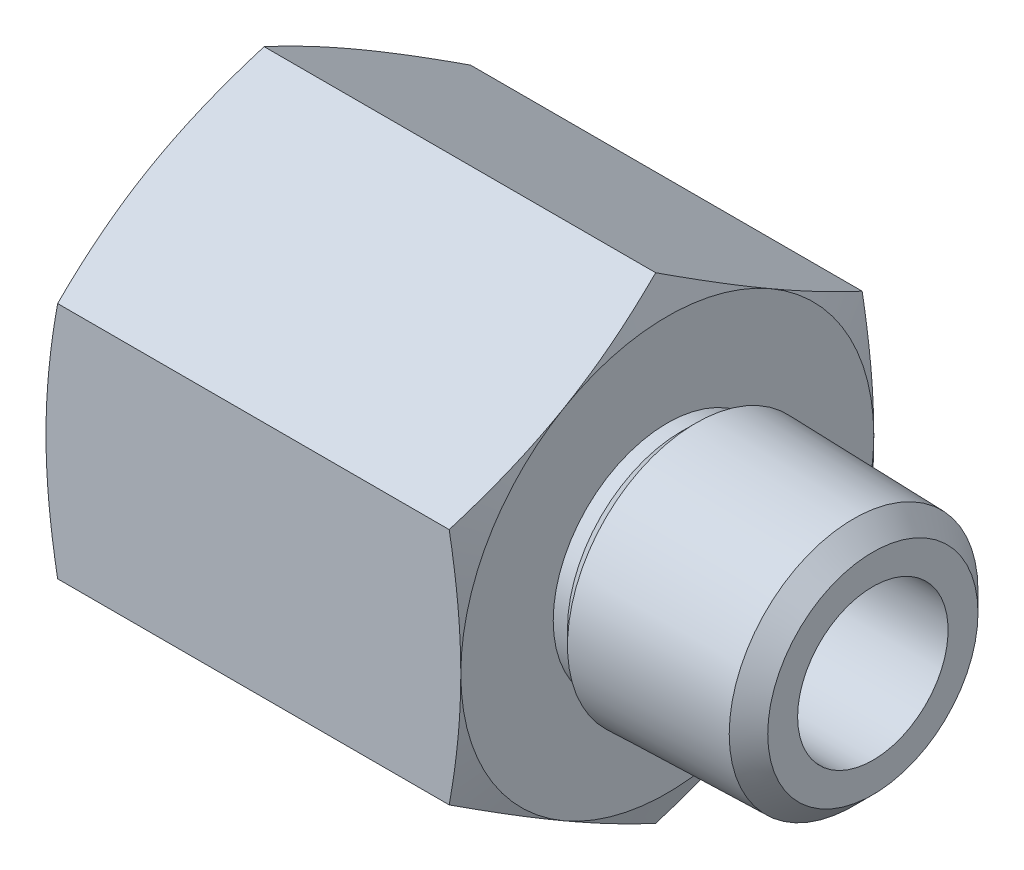
from build123d import *

# Parameters (mm, degrees)
EXTRUDE1_DEPTH     = 28.702
SKETCH3_OUTSIDE_W  = 244.651
SKETCH3_OUTSIDE_H  = 249.072
SKETCH3_OUTSIDE_R  = 14.2875
CUT_EXTRUDE1_DEPTH = 37.057098264
CUT_EXTRUDE1_DRAFT = -70
SKETCH4_OUTSIDE_W  = 244.652
SKETCH4_OUTSIDE_H  = 249.072
SKETCH4_OUTSIDE_R  = 14.2875
CUT_EXTRUDE2_DEPTH = 37.057098264
CUT_EXTRUDE2_DRAFT = -70
SKETCH5_R          = 8.5725
EXTRUDE2_DEPTH     = 14.224
EXTRUDE2_DRAFT     = 1.5
SKETCH7_R          = 10.668
CUT_EXTRUDE4_DEPTH = 37.591086429
CUT_EXTRUDE4_DRAFT = 1.5
SKETCH12_W         = 6.35
SKETCH12_H         = 16.497783942
SKETCH15_R         = 11.276975829
CUT_EXTRUDE7_DEPTH = 5.08
CUT_EXTRUDE7_DRAFT = -45


with BuildPart() as part:
    # Sketch2 → Extrude1 (new body)
    with BuildSketch(Plane(origin=(-21.463, 0, 0), x_dir=(0, 0, -1), z_dir=(1, 0, 0))):
        Polygon((0, 16.497783942), (-14.2875, 8.248891971), (-14.2875, -8.248891971), (0, -16.497783942), (14.2875, -8.248891971), (14.2875, 8.248891971), align=None)
    extrude(amount=EXTRUDE1_DEPTH)


with BuildPart() as cut_extrude1_tool:
    # Sketch3 outside → Cut-Extrude1 (with draft: the straight prism first)
    with BuildSketch(Plane(origin=(7.239, 0, 0), x_dir=(0, 0, -1), z_dir=(1, 0, 0))):
        with Locations((-0.0005, 0)):
            Rectangle(SKETCH3_OUTSIDE_W, SKETCH3_OUTSIDE_H)
        Circle(SKETCH3_OUTSIDE_R, mode=Mode.SUBTRACT)
    extrude(amount=-CUT_EXTRUDE1_DEPTH)
    # Cut-Extrude1: the draft: its side faces are tilted about the plane it starts from
    cut_extrude1_sides = [cut_extrude1_tool.faces().sort_by_distance(p)[0] for p in [
        (-11.289549132, -124.536, 0.0005),
        (-11.289549132, 0, -122.325),
        (-11.289549132, 124.536, 0.0005),
        (-11.289549132, 0, 122.326),
        (-11.289549132, 0, 14.2875),
    ]]
    draft(cut_extrude1_sides, Plane(origin=(7.239, 0, 0), x_dir=(0, 0, -1), z_dir=(1, 0, 0)), CUT_EXTRUDE1_DRAFT)


with BuildPart() as part_1:
    add(part.part)

    # Cut-Extrude1: cut by cut_extrude1_tool
    add(cut_extrude1_tool.part, mode=Mode.SUBTRACT)


with BuildPart() as cut_extrude2_tool:
    # Sketch4 outside → Cut-Extrude2 (with draft: the straight prism first)
    with BuildSketch(Plane.ZY.offset(21.463)):
        Rectangle(SKETCH4_OUTSIDE_W, SKETCH4_OUTSIDE_H)
        Circle(SKETCH4_OUTSIDE_R, mode=Mode.SUBTRACT)
    extrude(amount=-CUT_EXTRUDE2_DEPTH)
    # Cut-Extrude2: the draft: its side faces are tilted about the plane it starts from
    cut_extrude2_sides = [cut_extrude2_tool.faces().sort_by_distance(p)[0] for p in [
        (-2.934450868, -124.536, 0),
        (-2.934450868, 0, 122.326),
        (-2.934450868, 124.536, 0),
        (-2.934450868, 0, -122.326),
        (-2.934450868, 0, -14.2875),
    ]]
    draft(cut_extrude2_sides, Plane.ZY.offset(21.463), CUT_EXTRUDE2_DRAFT)


with BuildPart() as part_2:
    add(part_1.part)

    # Cut-Extrude2: cut by cut_extrude2_tool
    add(cut_extrude2_tool.part, mode=Mode.SUBTRACT)


with BuildPart() as body_2:
    # Sketch5 → Extrude2 (with draft: the straight prism first)
    with BuildSketch(Plane(origin=(21.463, 0, 0), x_dir=(0, 0, -1), z_dir=(1, 0, 0))):
        Circle(SKETCH5_R)
    extrude(amount=-EXTRUDE2_DEPTH)
    # Extrude2: the draft: its side faces are tilted about the plane it starts from
    extrude2_sides = [body_2.faces().sort_by_distance(p)[0] for p in [
        (14.351, 0, 8.5725),
    ]]
    draft(extrude2_sides, Plane(origin=(21.463, 0, 0), x_dir=(0, 0, -1), z_dir=(1, 0, 0)), EXTRUDE2_DRAFT)

    # Sketch17 → Cut-Revolve2 (revolve, cut)
    with BuildSketch(Plane.XY, mode=Mode.PRIVATE) as cut_revolve2_sk:
        Polygon((21.463, 8.814890815), (21.463, 7.274956448), (19.923065632, 8.814890815), align=None)
        Polygon((7.239, 7.893804996), (8.226777778, 7.893804996), (9.528863597, 9.195890815), (7.239, 9.195890815), align=None)
    revolve(cut_revolve2_sk.sketch.rotate(Axis((-21.463, 0, 0), (1, 0, 0)), 270), axis=Axis((-21.463, 0, 0), (1, 0, 0)), mode=Mode.SUBTRACT)


with BuildPart() as cut_extrude4_tool:
    # Sketch7 → Cut-Extrude4 (with draft: the straight prism first)
    with BuildSketch(Plane(origin=(-7.90702, 0, 0), x_dir=(0, 0, -1), z_dir=(1, 0, 0))):
        Circle(SKETCH7_R)
    extrude(amount=-CUT_EXTRUDE4_DEPTH)
    # Cut-Extrude4: the draft: its side faces are tilted about the plane it starts from
    cut_extrude4_sides = [cut_extrude4_tool.faces().sort_by_distance(p)[0] for p in [
        (-26.702563214, 0, 10.668),
    ]]
    draft(cut_extrude4_sides, Plane(origin=(-7.90702, 0, 0), x_dir=(0, 0, -1), z_dir=(1, 0, 0)), CUT_EXTRUDE4_DRAFT)


with BuildPart() as part_3:
    add(part_2.part)

    # Cut-Extrude4: cut by cut_extrude4_tool
    add(cut_extrude4_tool.part, mode=Mode.SUBTRACT)


with BuildPart() as body_2_1:
    add(body_2.part)

    # Combine1: union part
    add(part_3.part)

    # Sketch12 → Cut-Revolve1 (revolve, cut)
    with BuildSketch(Plane.XY, mode=Mode.PRIVATE) as cut_revolve1_sk:
        Polygon((-7.90702, 10.078793431), (-7.90702, 0), (21.463, 0), (21.463, 5.207), (-3.035226569, 5.207), align=None)
        with Locations((-24.638, 8.248891971)):
            Rectangle(SKETCH12_W, SKETCH12_H)
    revolve(cut_revolve1_sk.sketch.rotate(Axis((-21.463, 0, 0), (1, 0, 0)), 90), axis=Axis((-21.463, 0, 0), (1, 0, 0)), mode=Mode.SUBTRACT)


with BuildPart() as cut_extrude7_tool:
    # Sketch15 → Cut-Extrude7 (with draft: the straight prism first)
    with BuildSketch(Plane.ZY.offset(21.463)):
        Circle(SKETCH15_R)
    extrude(amount=-CUT_EXTRUDE7_DEPTH)
    # Cut-Extrude7: the draft: its side faces are tilted about the plane it starts from
    cut_extrude7_sides = [cut_extrude7_tool.faces().sort_by_distance(p)[0] for p in [
        (-18.923, 0, -11.276975829),
    ]]
    draft(cut_extrude7_sides, Plane.ZY.offset(21.463), CUT_EXTRUDE7_DRAFT)


with BuildPart() as body_2_2:
    add(body_2_1.part)

    # Cut-Extrude7: cut by cut_extrude7_tool
    add(cut_extrude7_tool.part, mode=Mode.SUBTRACT)


solid = body_2_2.part
